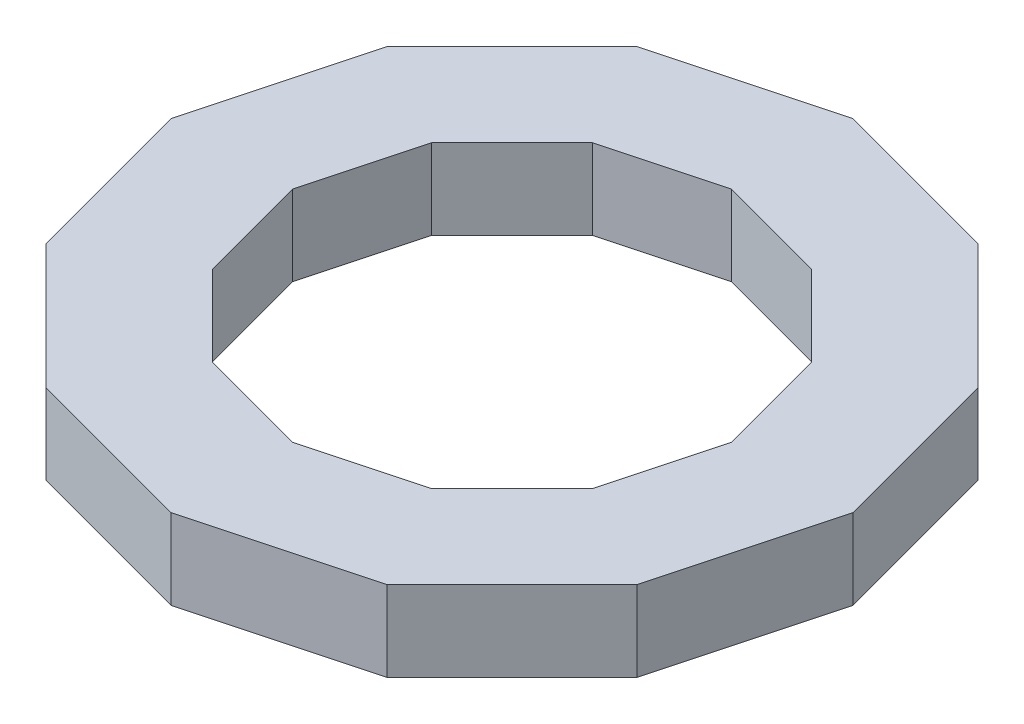
from build123d import *

# Parameters (mm, degrees)
BOSS_EXTRUDE1_DEPTH = 19.05


with BuildPart() as part:
    # Sketch1 → Boss-Extrude1 (new body)
    with BuildSketch(Plane(origin=(0, 0, 0), x_dir=(1, 0, 0), z_dir=(0, 1, 0))):
        Polygon((80.96390276, 0), (70.116796579, 40.48195138), (40.48195138, 70.116796579), (0, 80.96390276), (-40.48195138, 70.116796579), (-70.116796579, 40.48195138), (-80.96390276, 0), (-70.116796579, -40.48195138), (-40.48195138, -70.116796579), (0, -80.96390276), (40.48195138, -70.116796579), (70.116796579, -40.48195138), align=None)
        Polygon((52.038286279, 0), (45.066477887, 26.019143139), (26.019143139, 45.066477887), (0, 52.038286279), (-26.019143139, 45.066477887), (-45.066477887, 26.019143139), (-52.038286279, 0), (-45.066477887, -26.019143139), (-26.019143139, -45.066477887), (0, -52.038286279), (26.019143139, -45.066477887), (45.066477887, -26.019143139), align=None, mode=Mode.SUBTRACT)
    extrude(amount=BOSS_EXTRUDE1_DEPTH)


solid = part.part
